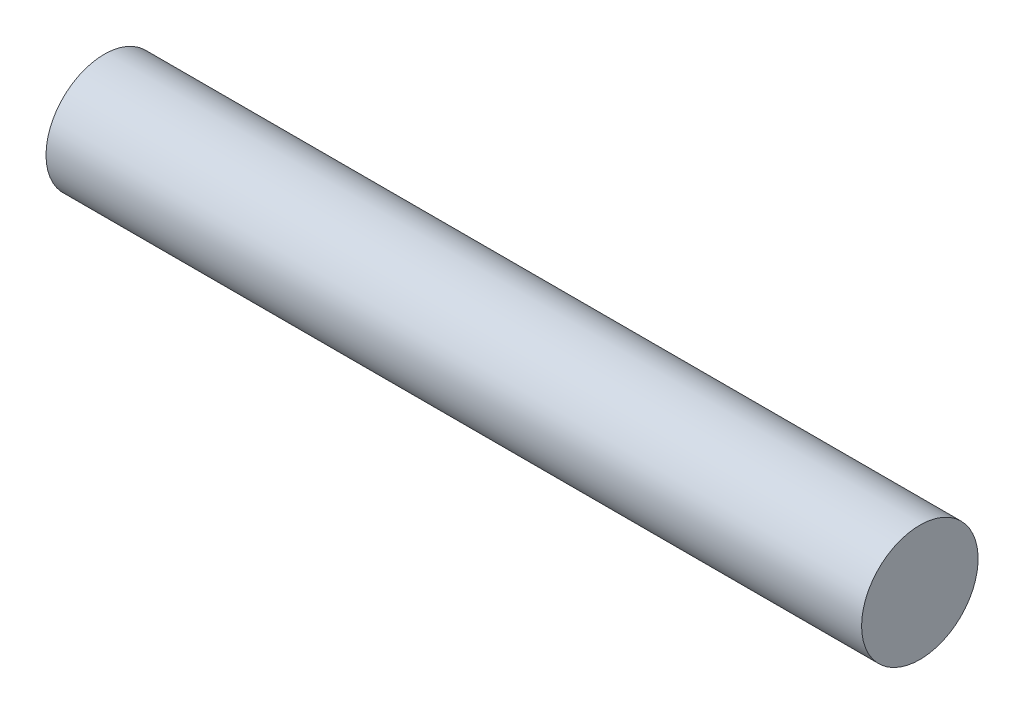
from build123d import *

# Parameters (mm, degrees)
SKETCH1_R           = 1
BOSS_EXTRUDE1_DEPTH = 7


with BuildPart() as part:
    # Sketch1 → Boss-Extrude1 (new, symmetric)
    with BuildSketch(Plane(origin=(0, 0, 0), x_dir=(0, 0, -1), z_dir=(1, 0, 0))):
        with Locations(Location((0, 0, 0), (0, 0, 180))):
            Circle(SKETCH1_R)
    extrude(amount=BOSS_EXTRUDE1_DEPTH, both=True)


solid = part.part
